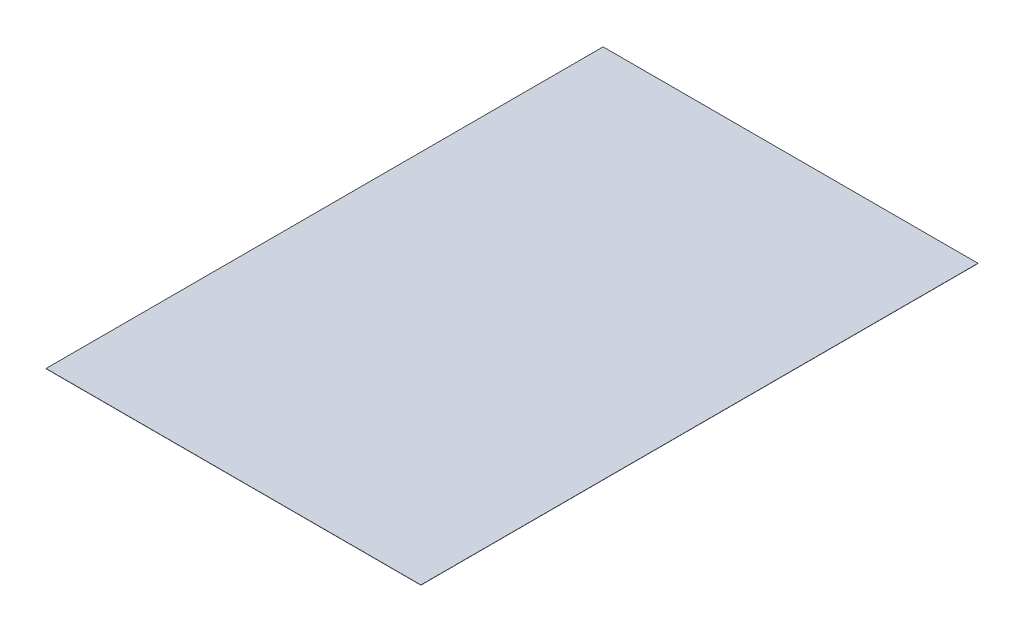
from build123d import *

# Parameters (mm, degrees)
SKETCH_1_W      = 2086
SKETCH_1_H      = 3100
EXTRUDE_1_DEPTH = 1


with BuildPart() as part:
    # Эскиз1 → Бобышка-Вытянуть1 (new body)
    with BuildSketch(Plane(origin=(0, 0, 0), x_dir=(1, 0, 0), z_dir=(0, 1, 0))):
        Rectangle(SKETCH_1_W, SKETCH_1_H)
    extrude(amount=EXTRUDE_1_DEPTH)


solid = part.part
